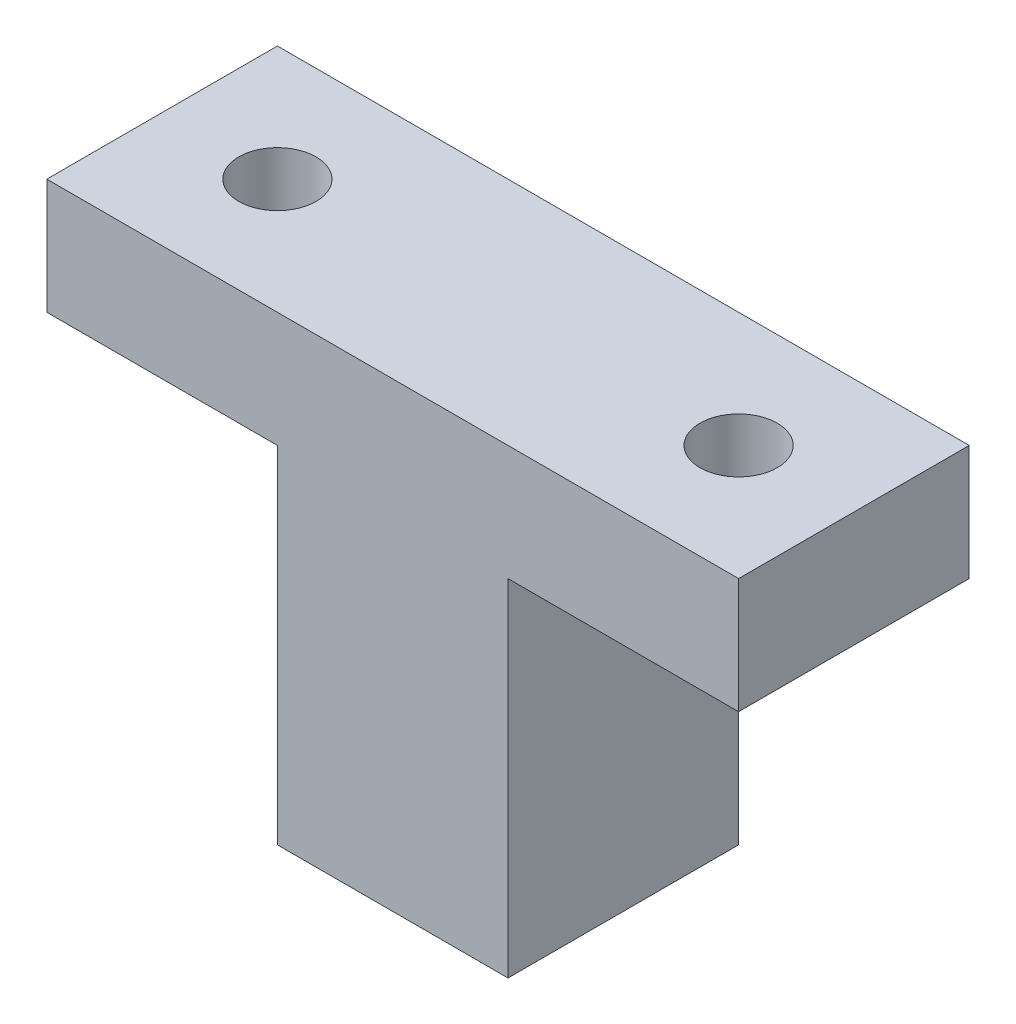
from build123d import *

# Parameters (mm, degrees)
EXTRUDE_1_DEPTH          = 10
CUT_EXTRUDE_1_DEPTH      = 24.452078799
CUT_EXTRUDE_1_DEPTH_BACK = 24.452078799
SKETCH_2_R               = 1.674991146


with BuildPart() as part:
    # ｽｹｯﾁ1 → ﾎﾞｽ - 押し出し1 (new body)
    with BuildSketch(Plane.XY):
        Polygon((-15, 0), (15, 0), (15, -5), (5, -5), (5, -20), (-5, -20), (-5, -5), (-15, -5), align=None)
    extrude(amount=EXTRUDE_1_DEPTH)

    # ｽｹｯﾁ2 → ｶｯﾄ - 押し出し1 (cut, two sides: drawn at the far end of the back side and taken through both)
    with BuildSketch(Plane.XZ.offset(5).offset(-CUT_EXTRUDE_1_DEPTH_BACK)):
        with Locations((-10, 5)):
            Circle(SKETCH_2_R)
        with Locations((10, 5)):
            Circle(SKETCH_2_R)
    extrude(amount=CUT_EXTRUDE_1_DEPTH + CUT_EXTRUDE_1_DEPTH_BACK, mode=Mode.SUBTRACT)


solid = part.part
